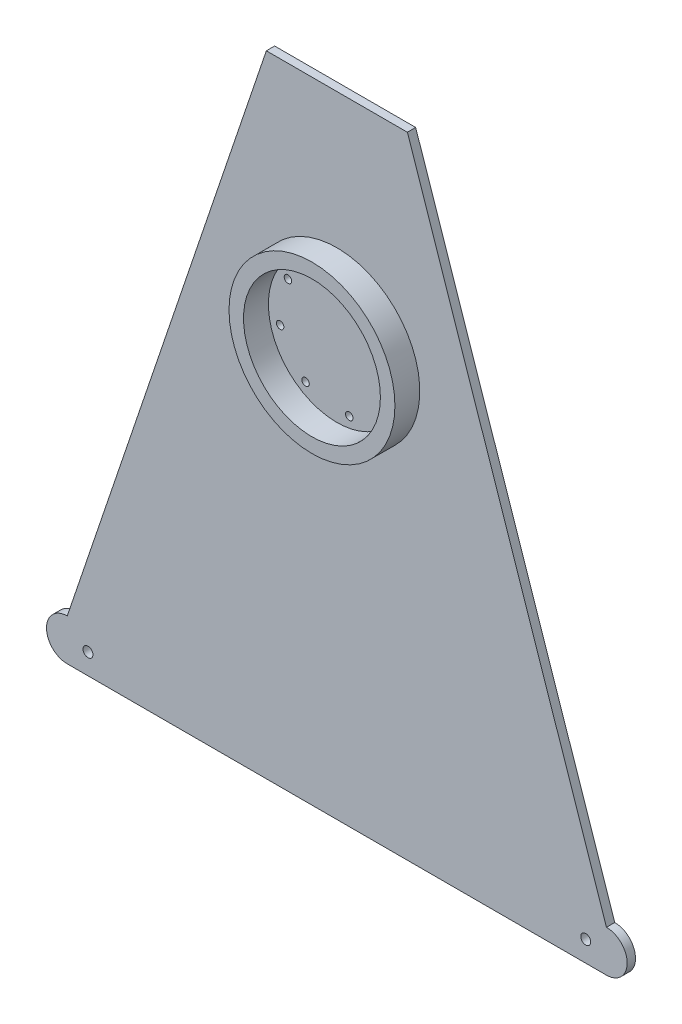
from build123d import *

# Parameters (mm, degrees)
SKETCH1_W           = 700
SKETCH1_H           = 50
SKETCH1_R           = 6
BOSS_EXTRUDE1_DEPTH = 10
FILLET1_RADIUS      = 25
FILLET1_LENGTH      = 10
FILLET2_RADIUS      = 25
FILLET2_LENGTH      = 10
BOSS_EXTRUDE2_DEPTH = 10
SKETCH3_R           = 100
SKETCH3_R_2         = 82.5
BOSS_EXTRUDE3_DEPTH = 30
SKETCH4_R           = 4.5
CUT_EXTRUDE1_DEPTH  = 815.631818676
CIRPATTERN1_COUNT   = 8


with BuildPart() as part:
    # Sketch1 → Boss-Extrude1 (new body)
    with BuildSketch(Plane.XY):
        Rectangle(SKETCH1_W, SKETCH1_H)
        with Locations((-300, 0)):
            Circle(SKETCH1_R, mode=Mode.SUBTRACT)
        with Locations((300, 0)):
            Circle(SKETCH1_R, mode=Mode.SUBTRACT)
    extrude(amount=BOSS_EXTRUDE1_DEPTH)

    # Fillet1: full round fillet: the end face becomes a half cylinder, R = half its width
    fillet1_face = Plane((-350, 0, 5), x_dir=(0, 0, 1), z_dir=(-1, 0, 0))  # on the end face: x along it, z out of the body
    fillet1_slab = fillet1_face.offset(-FILLET1_RADIUS / 2) * Box(FILLET1_LENGTH, 2 * FILLET1_RADIUS, FILLET1_RADIUS, mode=Mode.PRIVATE)  # the body's end, R deep
    fillet1_round = Plane((-325, 0, 5), x_dir=(-1, 0, 0), z_dir=(0, 0, 1)) * Cylinder(FILLET1_RADIUS, FILLET1_LENGTH, mode=Mode.PRIVATE)  # its axis R under the face
    add(fillet1_slab - fillet1_round, mode=Mode.SUBTRACT)

    # Fillet2: full round fillet: the end face becomes a half cylinder, R = half its width
    fillet2_face = Plane((350, 0, 5), x_dir=(0, 0, -1), z_dir=(1, 0, 0))  # on the end face: x along it, z out of the body
    fillet2_slab = fillet2_face.offset(-FILLET2_RADIUS / 2) * Box(FILLET2_LENGTH, 2 * FILLET2_RADIUS, FILLET2_RADIUS, mode=Mode.PRIVATE)  # the body's end, R deep
    fillet2_round = Plane((325, 0, 5), x_dir=(1, 0, 0), z_dir=(0, 0, -1)) * Cylinder(FILLET2_RADIUS, FILLET2_LENGTH, mode=Mode.PRIVATE)  # its axis R under the face
    add(fillet2_slab - fillet2_round, mode=Mode.SUBTRACT)

    # Sketch2 → Boss-Extrude2 (add)
    with BuildSketch(Plane.XY.offset(10)):
        Polygon((-325, 25), (-85, 735), (85, 735), (325, 25), align=None)
    extrude(amount=-BOSS_EXTRUDE2_DEPTH)

    # Sketch3 → Boss-Extrude3 (add)
    with BuildSketch(Plane.XY.offset(10)):
        with Locations(Location((0, 472, 0), (0, 0, 180))):
            Circle(SKETCH3_R)
        with Locations((0, 472)):
            Circle(SKETCH3_R_2, mode=Mode.SUBTRACT)
    extrude(amount=BOSS_EXTRUDE3_DEPTH)

    # Sketch4 → Cut-Extrude1 (cut, through all)
    with BuildSketch(Plane.XY.offset(10)):
        with Locations((-37.739196917, 413.044482735)):
            Circle(SKETCH4_R)
    cut_extrude1 = extrude(amount=-CUT_EXTRUDE1_DEPTH, mode=Mode.SUBTRACT)

    # CirPattern1: Cut-Extrude1 ×8 about axis
    cirpattern1_axis = Axis((0, 472, 0), (0, 0, 1))
    for i in range(1, CIRPATTERN1_COUNT):
        add(cut_extrude1.rotate(cirpattern1_axis, i * 360 / CIRPATTERN1_COUNT), mode=Mode.SUBTRACT)


solid = part.part
